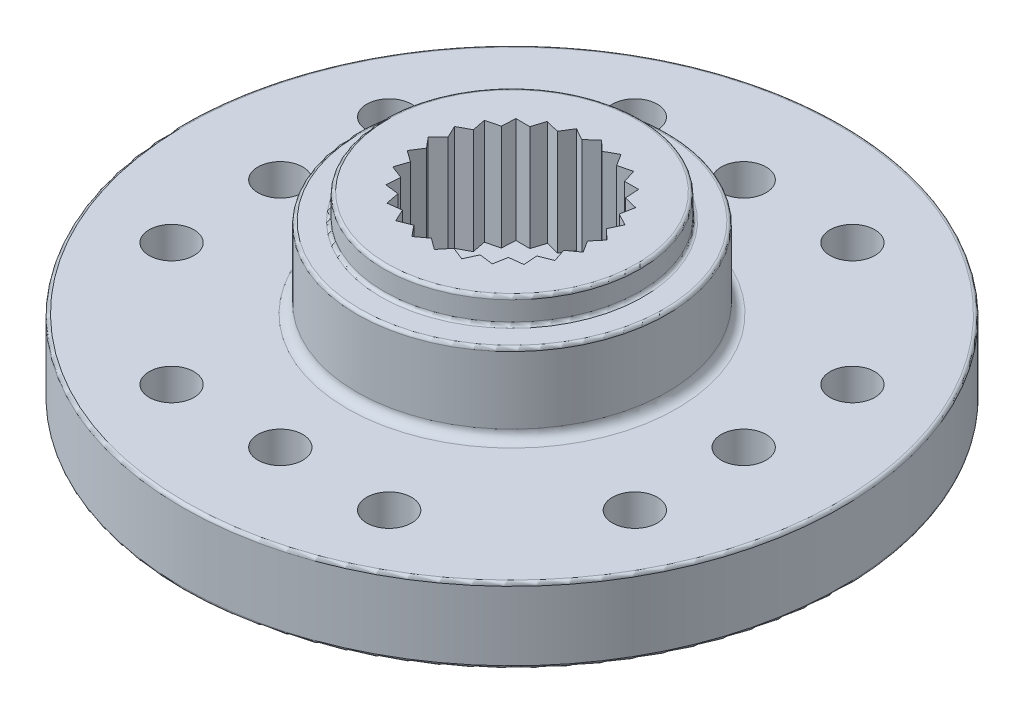
from build123d import *

# Parameters (mm, degrees)
SKETCH1_R           = 10.3
SKETCH1_R_2         = 1.39
BOSS_EXTRUDE1_DEPTH = 2.35
SKETCH2_R           = 4.85
BOSS_EXTRUDE2_DEPTH = 3.3
CUT_EXTRUDE1_START  = -0.8
SKETCH3_R           = 4.85
SKETCH3_R_2         = 4
CUT_EXTRUDE1_DEPTH  = 0.8
SKETCH4_R           = 4.4
SKETCH4_R_2         = 3.35
SKETCH4_R_3         = 2.85
SKETCH4_R_4         = 1.39
CUT_EXTRUDE2_DEPTH  = 1.7
SKETCH5_R           = 0.7
CUT_EXTRUDE3_DEPTH  = 16.623779952
FILLET1_R           = 0.1
FILLET2_R           = 0.3


with BuildPart() as part:
    # Sketch1 → Boss-Extrude1 (new body)
    with BuildSketch(Plane(origin=(0, 0, 0), x_dir=(1, 0, 0), z_dir=(0, 1, 0))):
        with Locations(Location((0, 0, 0), (0, 0, 270))):
            Circle(SKETCH1_R)
        with Locations(Location((0, 0, 0), (0, 0, 270))):
            Circle(SKETCH1_R_2, mode=Mode.SUBTRACT)
    extrude(amount=BOSS_EXTRUDE1_DEPTH)

    # Sketch2 → Boss-Extrude2 (add)
    with BuildSketch(Plane(origin=(0, 2.35, 0), x_dir=(1, 0, 0), z_dir=(0, 1, 0))):
        with Locations(Location((0, 0, 0), (0, 0, 270))):
            Circle(SKETCH2_R)
        Polygon((0, 2.8), (-0.315823446, 2.5), (-0.696331684, 2.712032851), (-0.92762599, 2.342915806), (-1.348910287, 2.453658704), (-1.481142381, 2.038617595), (-1.916731897, 2.041112157), (-1.941593149, 1.606225543), (-2.364118191, 1.500315026), (-2.280046479, 1.072908432), (-2.662958246, 0.865247584), (-2.475236103, 0.47217654), (-2.79447484, 0.175813455), (-2.514897539, -0.158223942), (-2.750404302, -0.524667681), (-2.396538714, -0.778682631), (-2.533515747, -1.192182016), (-2.127596548, -1.350213827), (-2.15743708, -1.784787171), (-1.724969666, -1.836906122), (-1.645798706, -2.265247584), (-1.213956596, -2.20817885), (-1.030748748, -2.60337416), (-0.626666168, -2.44070358), (-0.350933054, -2.777921164), (0, -2.519869927), (0.350933054, -2.777921164), (0.626666168, -2.44070358), (1.030748748, -2.60337416), (1.213956596, -2.20817885), (1.645798706, -2.265247584), (1.724969666, -1.836906122), (2.15743708, -1.784787171), (2.127596548, -1.350213827), (2.533515747, -1.192182016), (2.396538714, -0.778682631), (2.750404302, -0.524667681), (2.514897539, -0.158223942), (2.79447484, 0.175813455), (2.475236103, 0.47217654), (2.662958246, 0.865247584), (2.280046479, 1.072908432), (2.364118191, 1.500315026), (1.941593149, 1.606225543), (1.916731897, 2.041112157), (1.481142381, 2.038617595), (1.348910287, 2.453658704), (0.92762599, 2.342915806), (0.696331684, 2.712032851), (0.315823446, 2.5), align=None, mode=Mode.SUBTRACT)
    extrude(amount=BOSS_EXTRUDE2_DEPTH)

    # Sketch3 → Cut-Extrude1 (cut)
    with BuildSketch(Plane(origin=(0, 5.65, 0), x_dir=(1, 0, 0), z_dir=(0, 1, 0)).offset(CUT_EXTRUDE1_START)):
        with Locations(Location((0, 0, 0), (0, 0, 270))):
            Circle(SKETCH3_R)
        with Locations(Location((0, 0, 0), (0, 0, 270))):
            Circle(SKETCH3_R_2, mode=Mode.SUBTRACT)
    extrude(amount=CUT_EXTRUDE1_DEPTH, mode=Mode.SUBTRACT)

    # Sketch4 → Cut-Extrude2 (cut)
    # profile 1 of 2: a face of its own
    with BuildSketch(Plane(origin=(0, 0, 0), x_dir=(-1, 0, 0), z_dir=(0, -1, 0))):
        with Locations(Location((0, 0, 0), (0, 0, 90))):
            Circle(SKETCH4_R)
        with Locations(Location((0, 0, 0), (0, 0, 90))):
            Circle(SKETCH4_R_2, mode=Mode.SUBTRACT)
    # profile 2 of 2: a face of its own
    with BuildSketch(Plane(origin=(0, 0, 0), x_dir=(-1, 0, 0), z_dir=(0, -1, 0))):
        with Locations(Location((0, 0, 0), (0, 0, 90))):
            Circle(SKETCH4_R_3)
        with Locations(Location((0, 0, 0), (0, 0, 90))):
            Circle(SKETCH4_R_4, mode=Mode.SUBTRACT)
    extrude(amount=-CUT_EXTRUDE2_DEPTH, mode=Mode.SUBTRACT)

    # Sketch5 → Cut-Extrude3 (cut, through all)
    with BuildSketch(Plane.XZ):
        with Locations(Location((0, 7.24, 0), (0, 0, 270))):
            Circle(SKETCH5_R)
        with Locations(Location((3.4, 7.24, 0), (0, 0, 270))):
            Circle(SKETCH5_R)
        with Locations(Location((-3.4, 7.24, 0), (0, 0, 270))):
            Circle(SKETCH5_R)
        with Locations(Location((7.24, 0, 0), (0, 0, 270))):
            Circle(SKETCH5_R)
        with Locations(Location((7.24, -3.4, 0), (0, 0, 270))):
            Circle(SKETCH5_R)
        with Locations(Location((7.24, 3.4, 0), (0, 0, 270))):
            Circle(SKETCH5_R)
        with Locations(Location((0, -7.24, 0), (0, 0, 270))):
            Circle(SKETCH5_R)
        with Locations(Location((-3.4, -7.24, 0), (0, 0, 270))):
            Circle(SKETCH5_R)
        with Locations(Location((3.4, -7.24, 0), (0, 0, 270))):
            Circle(SKETCH5_R)
        with Locations(Location((-7.24, 0, 0), (0, 0, 270))):
            Circle(SKETCH5_R)
        with Locations(Location((-7.24, 3.4, 0), (0, 0, 270))):
            Circle(SKETCH5_R)
        with Locations(Location((-7.24, -3.4, 0), (0, 0, 270))):
            Circle(SKETCH5_R)
    extrude(amount=-CUT_EXTRUDE3_DEPTH, mode=Mode.SUBTRACT)

    # Fillet1
    fillet1_edges = [part.edges().sort_by_distance(p)[0] for p in [
        (0, 4.85, -4.85),
        (0, 4.85, -4),
        (0, 5.65, -4),
        (0, 0, -10.3),
        (0, 2.35, -10.3),
    ]]
    fillet(fillet1_edges, radius=FILLET1_R)

    # Fillet2
    fillet2_edges = [part.edges().sort_by_distance(p)[0] for p in [
        (0, 2.35, -4.85),
    ]]
    fillet(fillet2_edges, radius=FILLET2_R)


solid = part.part
